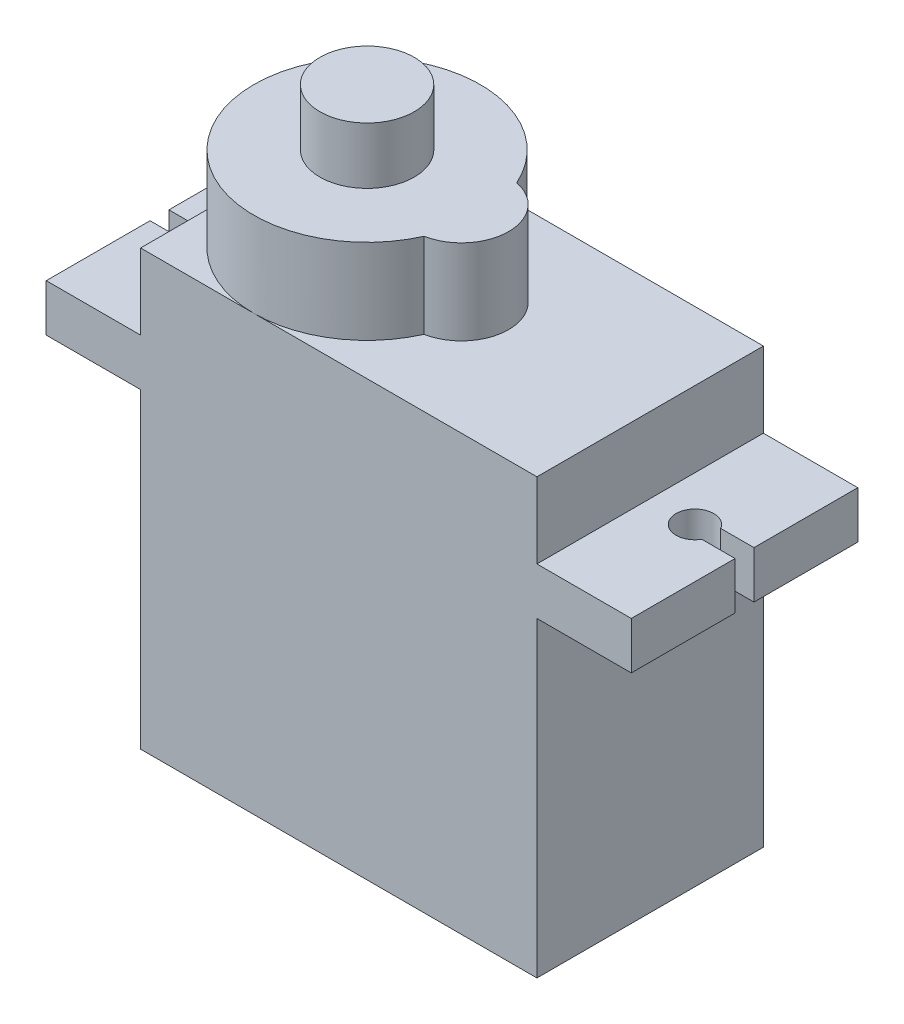
from build123d import *

# Parameters (mm, degrees)
SKETCH1_W               = 21
SKETCH1_H               = 12
BOSS_EXTRUDE1_DEPTH     = 23
SKETCH2_W               = 5
SKETCH2_H               = 2.5
BOSS_EXTRUDE2_DEPTH     = 12
CUT_EXTRUDE2_DEPTH      = 29.376927247
CUT_EXTRUDE2_DEPTH_BACK = 12
BOSS_EXTRUDE3_DEPTH     = 4.5
SKETCH5_R               = 2.5
BOSS_EXTRUDE4_DEPTH     = 3


with BuildPart() as part:
    # Sketch1 → Boss-Extrude1 (new body)
    with BuildSketch(Plane(origin=(0, 0, 0), x_dir=(1, 0, 0), z_dir=(0, 1, 0))):
        Rectangle(SKETCH1_W, SKETCH1_H)
    extrude(amount=BOSS_EXTRUDE1_DEPTH)

    # Sketch2 → Boss-Extrude2 (add)
    with BuildSketch(Plane.XY.offset(6)):
        with Locations((13, 17.75)):
            Rectangle(SKETCH2_W, SKETCH2_H)
        with Locations((-13, 17.75)):
            Rectangle(SKETCH2_W, SKETCH2_H)
    extrude(amount=-BOSS_EXTRUDE2_DEPTH)

    # Sketch3 → Cut-Extrude2 (cut, two sides: drawn at the far end of the back side and taken through both)
    with BuildSketch(Plane(origin=(0, 23, 0), x_dir=(1, 0, 0), z_dir=(0, 1, 0)).offset(-CUT_EXTRUDE2_DEPTH_BACK)):
        with BuildLine():
            Line((15.5, 0.5), (15.5, -0.5))
            Line((15.5, -0.5), (13.737359872, -0.5))
            ThreePointArc((13.737359872, -0.5), (11.871334468, 0), (13.737359872, 0.5))
            Line((13.737359872, 0.5), (15.5, 0.5))
        make_face()
        with BuildLine():
            Line((-15.5, 0.5), (-13.737359872, 0.5))
            ThreePointArc((-13.737359872, 0.5), (-11.871334468, 0), (-13.737359872, -0.5))
            Line((-13.737359872, -0.5), (-15.5, -0.5))
            Line((-15.5, -0.5), (-15.5, 0.5))
        make_face()
    extrude(amount=CUT_EXTRUDE2_DEPTH + CUT_EXTRUDE2_DEPTH_BACK, mode=Mode.SUBTRACT)

    # Sketch4 → Boss-Extrude3 (add)
    with BuildSketch(Plane(origin=(0, 23, 0), x_dir=(1, 0, 0), z_dir=(0, 1, 0))):
        with BuildLine():
            ThreePointArc((0.975, 2.454460226), (-10.5, 0), (0.975, -2.454460226))
            ThreePointArc((0.975, -2.454460226), (3, 0), (0.975, 2.454460226))
        make_face()
    extrude(amount=BOSS_EXTRUDE3_DEPTH)

    # Sketch5 → Boss-Extrude4 (add)
    with BuildSketch(Plane(origin=(0, 27.5, 0), x_dir=(1, 0, 0), z_dir=(0, 1, 0))):
        with Locations(Location((-4.5, 0, 0), (0, 0, 270))):
            Circle(SKETCH5_R)
    extrude(amount=BOSS_EXTRUDE4_DEPTH)


solid = part.part
